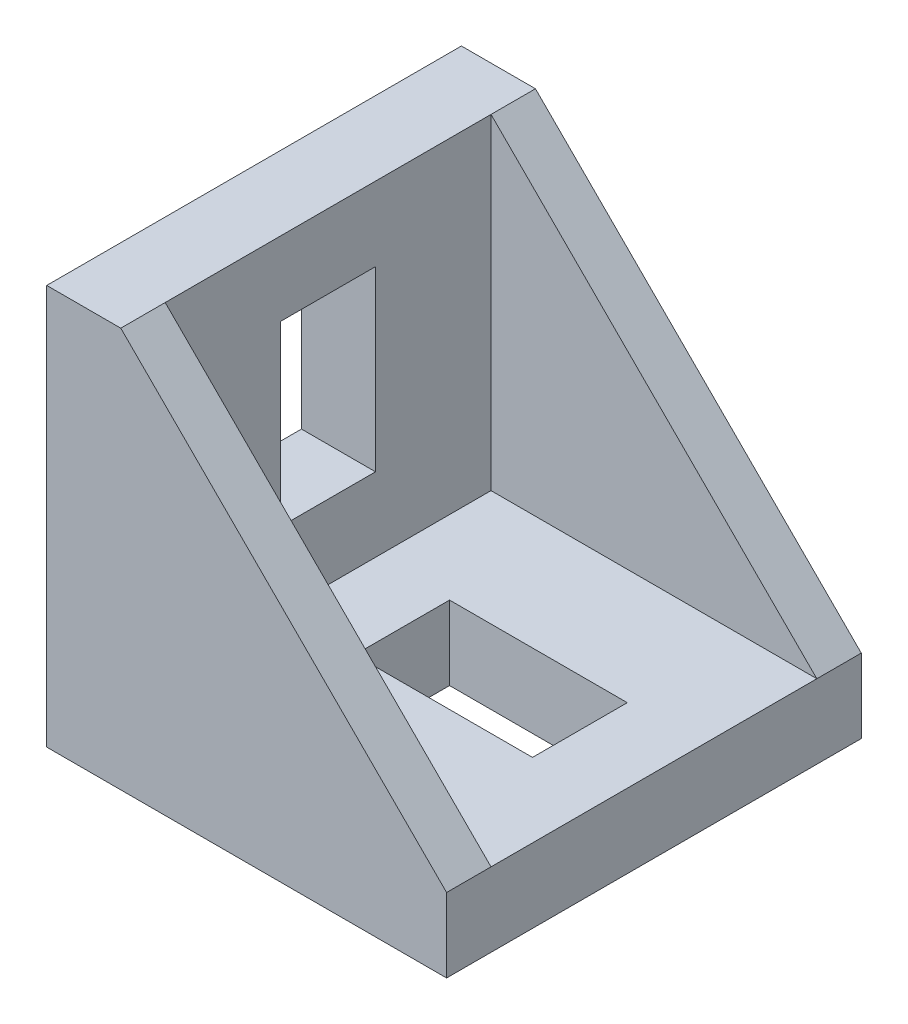
from build123d import *

# Parameters (mm, degrees)
BOSS_EXTRUDE1_DEPTH = 28
BOSS_EXTRUDE2_DEPTH = 3
BOSS_EXTRUDE3_DEPTH = 3
SKETCH4_W           = 6.4
SKETCH4_H           = 12
CUT_EXTRUDE1_DEPTH  = 5
SKETCH5_W           = 12
SKETCH5_H           = 6.4
CUT_EXTRUDE2_DEPTH  = 5


with BuildPart() as part:
    # Sketch1 → Boss-Extrude1 (new body)
    with BuildSketch(Plane.XY):
        Polygon((5, 5), (5, 27), (0, 27), (0, 0), (27, 0), (27, 5), align=None)
    extrude(amount=BOSS_EXTRUDE1_DEPTH)

    # Sketch1<3> → Boss-Extrude2 (add)
    with BuildSketch(Plane.XY):
        Polygon((27, 5), (5, 27), (5, 5), align=None)
    extrude(amount=BOSS_EXTRUDE2_DEPTH)

    # Sketch3 → Boss-Extrude3 (add)
    with BuildSketch(Plane.XY.offset(28)):
        Polygon((5, 27), (27, 5), (5, 5), align=None)
    extrude(amount=-BOSS_EXTRUDE3_DEPTH)

    # Sketch4 → Cut-Extrude1 (cut)
    with BuildSketch(Plane(origin=(5, 0, 0), x_dir=(0, 0, -1), z_dir=(1, 0, 0))):
        with Locations((-14, 16)):
            Rectangle(SKETCH4_W, SKETCH4_H)
    extrude(amount=-CUT_EXTRUDE1_DEPTH, mode=Mode.SUBTRACT)

    # Sketch5 → Cut-Extrude2 (cut)
    with BuildSketch(Plane(origin=(0, 5, 0), x_dir=(1, 0, 0), z_dir=(0, 1, 0))):
        with Locations((16, -14)):
            Rectangle(SKETCH5_W, SKETCH5_H)
    extrude(amount=-CUT_EXTRUDE2_DEPTH, mode=Mode.SUBTRACT)


solid = part.part
